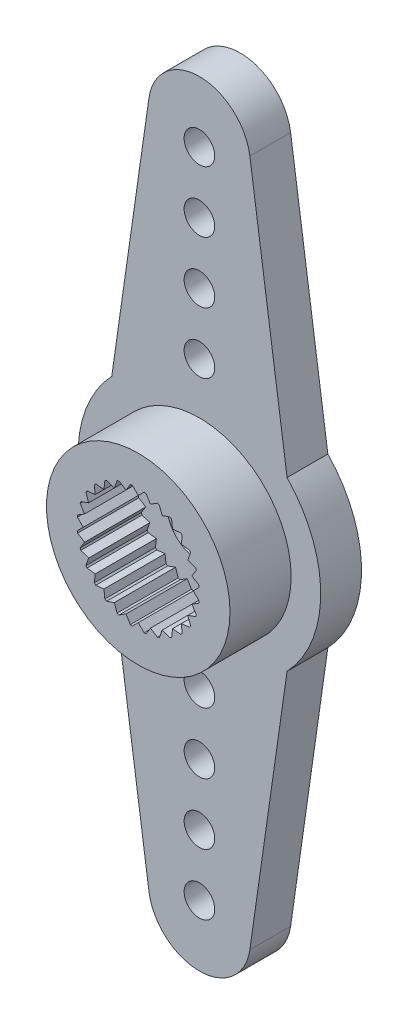
from build123d import *

# Parameters (mm, degrees)
ESQUISSE1_R                  = 5.95
ESQUISSE1_R_2                = 1.6
BOSS_EXTRU_1_DEPTH           = 5
ESQUISSE2_R                  = 3
ENL_V_MAT_EXTRU_1_DEPTH      = 3
ENL_V_START                  = -3
ESQUISSE3_R                  = 5.95
ESQUISSE3_R_2                = 4.5
ENL_V_MAT_EXTRU_2_DEPTH      = 3
BOSS_EXTRU_2_DEPTH           = 2
R_P_TITION_CIRCULAIRE1_COUNT = 2
ESQUISSE5_R                  = 0.75
ENL_V_MAT_EXTRU_3_DEPTH      = 3
R_P_TITION_CIRCULAIRE2_COUNT = 2
BOSS_EXTRU_3_DEPTH           = 3
R_P_TITION_CIRCULAIRE3_COUNT = 28
ENL_V_START_2                = -1
ESQUISSE7_R                  = 3
ESQUISSE7_R_2                = 1.6
ENL_V_MAT_EXTRU_4_DEPTH      = 1
ESQUISSE8_R                  = 4.7
ESQUISSE8_R_2                = 3.4
ENL_V_MAT_EXTRU_5_DEPTH      = 1


with BuildPart() as part:
    # Esquisse1 → Boss.-Extru.1 (new body)
    with BuildSketch(Plane.XY):
        Circle(ESQUISSE1_R)
        Circle(ESQUISSE1_R_2, mode=Mode.SUBTRACT)
    extrude(amount=BOSS_EXTRU_1_DEPTH)

    # Esquisse2 → Enlèv. mat.-Extru.1 (cut)
    with BuildSketch(Plane.XY.offset(5)):
        Circle(ESQUISSE2_R)
    extrude(amount=-ENL_V_MAT_EXTRU_1_DEPTH, mode=Mode.SUBTRACT)

    # Esquisse3 → Enlèv. mat.-Extru.2 (cut)
    with BuildSketch(Plane.XY.offset(5).offset(ENL_V_START)):
        Circle(ESQUISSE3_R)
        Circle(ESQUISSE3_R_2, mode=Mode.SUBTRACT)
    extrude(amount=ENL_V_MAT_EXTRU_2_DEPTH, mode=Mode.SUBTRACT)

    # Esquisse4 → Boss.-Extru.2 (add)
    with BuildSketch(Plane(origin=(0, 0, 0), x_dir=(-1, 0, 0), z_dir=(0, 0, -1))):
        with BuildLine():
            Line((-4.3, 4.112481003), (-2.474738327, 16.854499945))
            ThreePointArc((-2.474738327, 16.854499945), (0, 19), (2.474738327, 16.854499945))
            Line((2.474738327, 16.854499945), (4.3, 4.112481003))
            ThreePointArc((4.3, 4.112481003), (0, 5.95), (-4.3, 4.112481003))
        make_face()
    boss_extru_2 = extrude(amount=-BOSS_EXTRU_2_DEPTH)

    # Répétition circulaire1: Boss.-Extru.2 ×2 about axis
    r_p_tition_circulaire1_axis = Axis((0, 0, 0), (0, 0, 1))
    for i in range(1, R_P_TITION_CIRCULAIRE1_COUNT):
        add(boss_extru_2.rotate(r_p_tition_circulaire1_axis, i * 360 / R_P_TITION_CIRCULAIRE1_COUNT))

    # Esquisse5 → Enlèv. mat.-Extru.3 (cut)
    with BuildSketch(Plane(origin=(0, 0, 0), x_dir=(-1, 0, 0), z_dir=(0, 0, -1))):
        with Locations((0, 7)):
            Circle(ESQUISSE5_R)
        with Locations((0, 10)):
            Circle(ESQUISSE5_R)
        with Locations((0, 13)):
            Circle(ESQUISSE5_R)
        with Locations((0, 16)):
            Circle(ESQUISSE5_R)
    enl_v_mat_extru_3 = extrude(amount=-ENL_V_MAT_EXTRU_3_DEPTH, mode=Mode.SUBTRACT)

    # Répétition circulaire2: Enlèv. mat.-Extru.3 ×2 about axis
    r_p_tition_circulaire2_axis = Axis((0, 0, 0), (0, 0, 1))
    for i in range(1, R_P_TITION_CIRCULAIRE2_COUNT):
        add(enl_v_mat_extru_3.rotate(r_p_tition_circulaire2_axis, i * 360 / R_P_TITION_CIRCULAIRE2_COUNT), mode=Mode.SUBTRACT)

    # Esquisse6 → Boss.-Extru.3 (add)
    with BuildSketch(Plane.XY.offset(5)):
        Polygon((-0.3, 3), (0, 2.7), (0.3, 3), align=None)
    boss_extru_3 = extrude(amount=-BOSS_EXTRU_3_DEPTH)

    # Répétition circulaire3: Boss.-Extru.3 ×28 about axis
    r_p_tition_circulaire3_axis = Axis((0, 0, 0), (0, 0, 1))
    for i in range(1, R_P_TITION_CIRCULAIRE3_COUNT):
        add(boss_extru_3.rotate(r_p_tition_circulaire3_axis, i * 360 / R_P_TITION_CIRCULAIRE3_COUNT))

    # Esquisse7 → Enlèv. mat.-Extru.4 (cut)
    with BuildSketch(Plane(origin=(0, 0, 0), x_dir=(-1, 0, 0), z_dir=(0, 0, -1)).offset(ENL_V_START_2)):
        Circle(ESQUISSE7_R)
        Circle(ESQUISSE7_R_2, mode=Mode.SUBTRACT)
    extrude(amount=ENL_V_MAT_EXTRU_4_DEPTH, mode=Mode.SUBTRACT)

    # Esquisse8 → Enlèv. mat.-Extru.5 (cut)
    with BuildSketch(Plane(origin=(0, 0, 0), x_dir=(-1, 0, 0), z_dir=(0, 0, -1))):
        Circle(ESQUISSE8_R)
        Circle(ESQUISSE8_R_2, mode=Mode.SUBTRACT)
    extrude(amount=-ENL_V_MAT_EXTRU_5_DEPTH, mode=Mode.SUBTRACT)


solid = part.part
